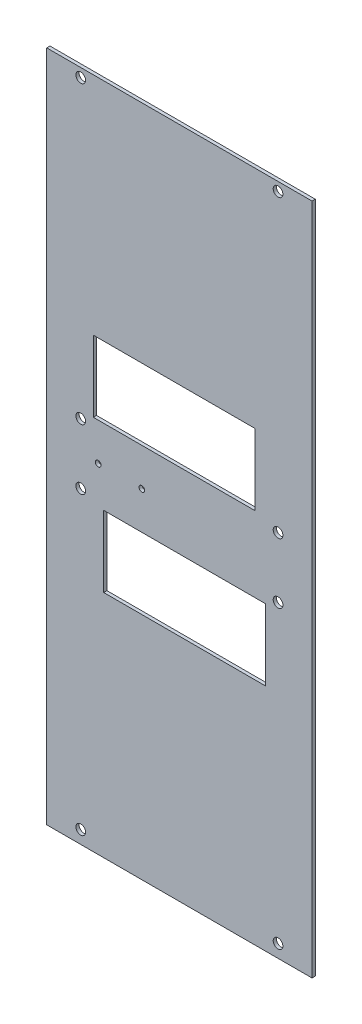
from build123d import *

# Parameters (mm, degrees)
SKETCH1_W                    = 83.2
SKETCH1_H                    = 208
BOSS_EXTRUDE1_DEPTH          = 1
F_3_0_3_DIAMETER_HOLE1_D     = 3
SKETCH4_W                    = 50
SKETCH4_H                    = 22
CUT_EXTRUDE1_DEPTH           = 10
F_1_75_1_75_DIAMETER_HOLE1_D = 1.75
SKETCH7_W                    = 129.020452682
SKETCH7_H                    = 252.80886061
SKETCH7_W_2                  = 82
SKETCH7_H_2                  = 208
CUT_EXTRUDE2_DEPTH           = 10


with BuildPart() as part:
    # Sketch1 → Boss-Extrude1 (new body)
    with BuildSketch(Plane.XY):
        Rectangle(SKETCH1_W, SKETCH1_H)
    extrude(amount=BOSS_EXTRUDE1_DEPTH)

    # Ø3.0 (3) Diameter Hole1 (through all)
    with Locations(Plane.XY.offset(1)):
        with Locations((-30.5, 10), (30.5, 10), (30.5, -100), (-30.5, -100), (-30.5, 101.3), (30.5, 101.3), (-30.5, -8.7), (30.5, -8.7)):
            Hole(F_3_0_3_DIAMETER_HOLE1_D / 2)

    # Sketch4 → Cut-Extrude1 (cut)
    with BuildSketch(Plane.XY.offset(1)):
        with Locations((1.6, -22)):
            Rectangle(SKETCH4_W, SKETCH4_H)
        with Locations((-1.6, 23.3)):
            Rectangle(SKETCH4_W, SKETCH4_H)
    extrude(amount=-CUT_EXTRUDE1_DEPTH, mode=Mode.SUBTRACT)

    # Ø1.75 (1.75) Diameter Hole1 (through all)
    with Locations(Plane.XY.offset(1)):
        with Locations((-25.099975914, 0.65), (-11.599975914, 0.65)):
            Hole(F_1_75_1_75_DIAMETER_HOLE1_D / 2)

    # Sketch7 → Cut-Extrude2 (cut)
    with BuildSketch(Plane.XY.offset(1)):
        Rectangle(SKETCH7_W, SKETCH7_H)
        Rectangle(SKETCH7_W_2, SKETCH7_H_2, mode=Mode.SUBTRACT)
    extrude(amount=-CUT_EXTRUDE2_DEPTH, mode=Mode.SUBTRACT)


solid = part.part
